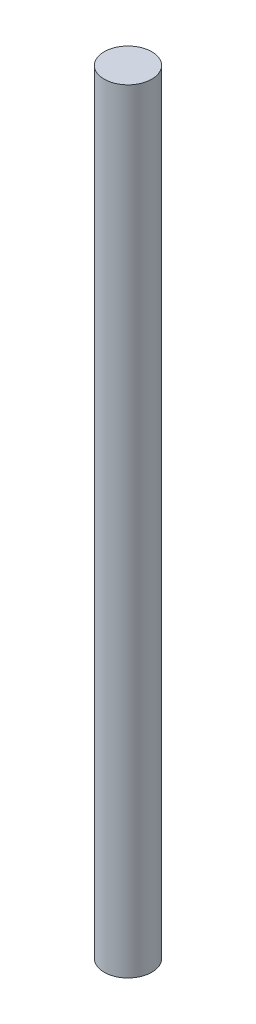
from build123d import *

# Parameters (mm, degrees)
SKETCH1_R           = 4
BOSS_EXTRUDE1_DEPTH = 130


with BuildPart() as part:
    # Sketch1 → Boss-Extrude1 (new body)
    with BuildSketch(Plane(origin=(0, 0, 0), x_dir=(1, 0, 0), z_dir=(0, 1, 0))):
        with Locations(Location((0, 0, 0), (0, 0, 270))):
            Circle(SKETCH1_R)
    extrude(amount=BOSS_EXTRUDE1_DEPTH)


solid = part.part
